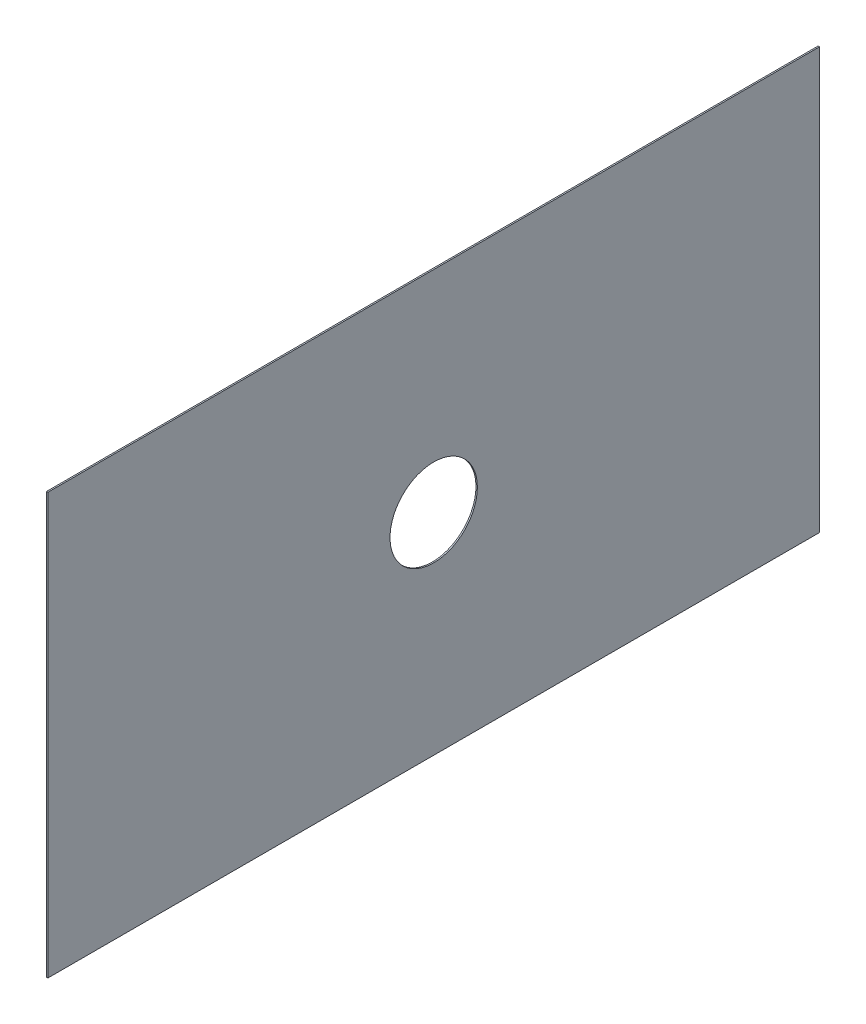
from build123d import *

# Parameters (mm, degrees)
CROQUIS1_W     = 1104
CROQUIS1_H     = 602
EXTRUIR1_DEPTH = 2
CROQUIS2_R     = 62.5
EXTRUIR2_DEPTH = 2


with BuildPart() as part:
    # Croquis1 → Extruir1 (new body)
    with BuildSketch(Plane(origin=(0, 0, 0), x_dir=(0, 0, -1), z_dir=(1, 0, 0))):
        Rectangle(CROQUIS1_W, CROQUIS1_H)
    extrude(amount=EXTRUIR1_DEPTH)

    # Croquis2 → Extruir2 (cut)
    with BuildSketch(Plane(origin=(2, 0, 0), x_dir=(0, 0, -1), z_dir=(1, 0, 0))):
        Circle(CROQUIS2_R)
    extrude(amount=-EXTRUIR2_DEPTH, mode=Mode.SUBTRACT)


solid = part.part
